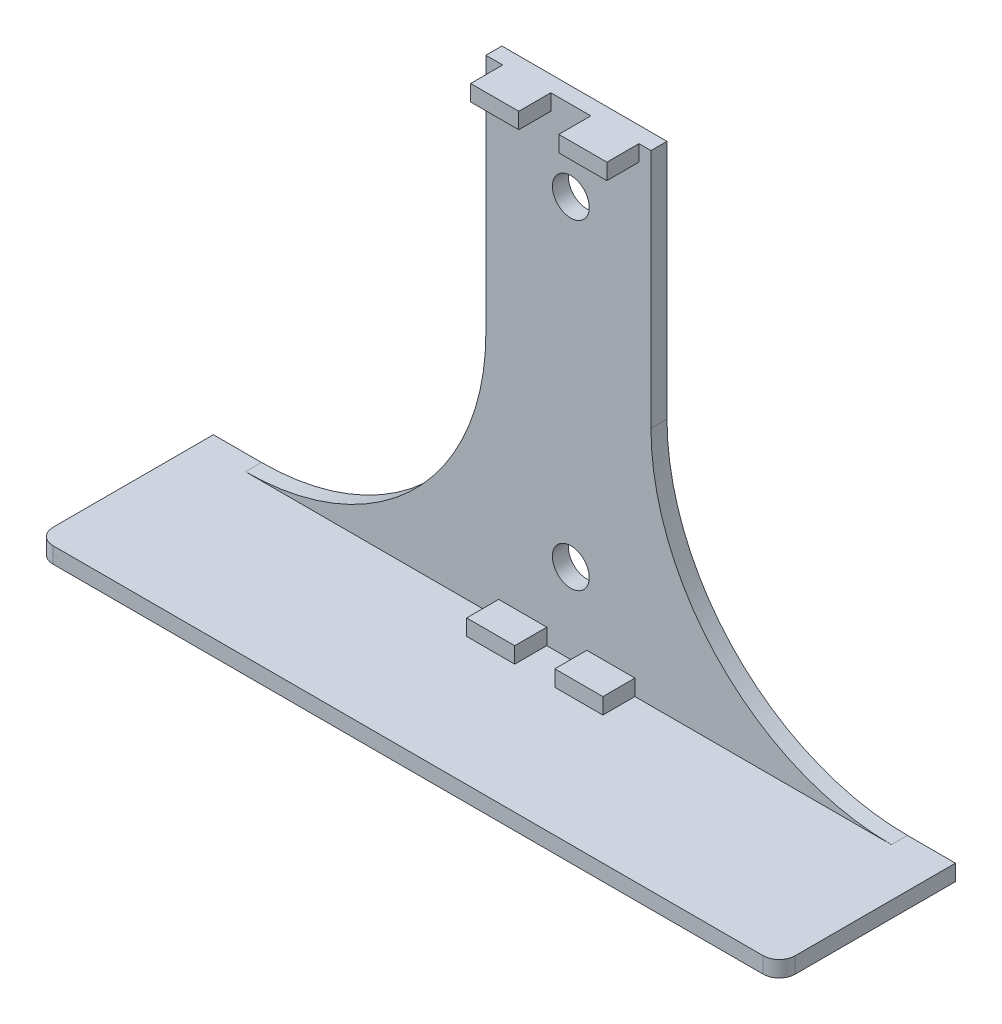
from build123d import *

# Parameters (mm, degrees)
SKETCH1_W           = 92.6
SKETCH1_H           = 22
BOSS_EXTRUDE1_DEPTH = 2
FILLET1_R           = 2
SKETCH5_W           = 20.6
SKETCH5_H           = 2
BOSS_EXTRUDE3_DEPTH = 60
SKETCH6_W           = 6
SKETCH6_H           = 2
BOSS_EXTRUDE4_DEPTH = 4
SKETCH7_R           = 2.3
CUT_EXTRUDE1_DEPTH  = 2
FILLET4_R           = 30


with BuildPart() as part:
    # Sketch1 → Boss-Extrude1 (new body)
    with BuildSketch(Plane(origin=(0, 0, 0), x_dir=(1, 0, 0), z_dir=(0, 1, 0))):
        with Locations((-146.346488806, 73.566618989)):
            Rectangle(SKETCH1_W, SKETCH1_H)
    extrude(amount=BOSS_EXTRUDE1_DEPTH)

    # Fillet1
    fillet1_edges = [part.edges().sort_by_distance(p)[0] for p in [
        (-100.046488806, 1, -62.566618989),
        (-192.646488806, 1, -62.566618989),
    ]]
    fillet(fillet1_edges, radius=FILLET1_R)

    # Sketch5 → Boss-Extrude3 (add)
    with BuildSketch(Plane(origin=(0, 2, 0), x_dir=(1, 0, 0), z_dir=(0, 1, 0))):
        with Locations((-146.346488806, 83.566618989)):
            Rectangle(SKETCH5_W, SKETCH5_H)
    extrude(amount=BOSS_EXTRUDE3_DEPTH)

    # Sketch6 → Boss-Extrude4 (add)
    with BuildSketch(Plane.XY.offset(-82.566618989)):
        with Locations((-151.546488806, 61)):
            Rectangle(SKETCH6_W, SKETCH6_H)
        with Locations((-140.546488806, 61)):
            Rectangle(SKETCH6_W, SKETCH6_H)
        with Locations((-152.046488806, 3)):
            Rectangle(SKETCH6_W, SKETCH6_H)
        with Locations((-141.046488806, 3)):
            Rectangle(SKETCH6_W, SKETCH6_H)
    extrude(amount=BOSS_EXTRUDE4_DEPTH)

    # Sketch7 → Cut-Extrude1 (cut)
    with BuildSketch(Plane.XY.offset(-82.566618989)):
        with Locations((-146.046488806, 52)):
            Circle(SKETCH7_R)
        with Locations((-146.046488806, 12)):
            Circle(SKETCH7_R)
    extrude(amount=-CUT_EXTRUDE1_DEPTH, mode=Mode.SUBTRACT)

    # Fillet4
    fillet4_edges = [part.edges().sort_by_distance(p)[0] for p in [
        (-156.646488806, 2, -83.566618989),
        (-136.046488806, 2, -83.566618989),
    ]]
    fillet(fillet4_edges, radius=FILLET4_R)


solid = part.part
